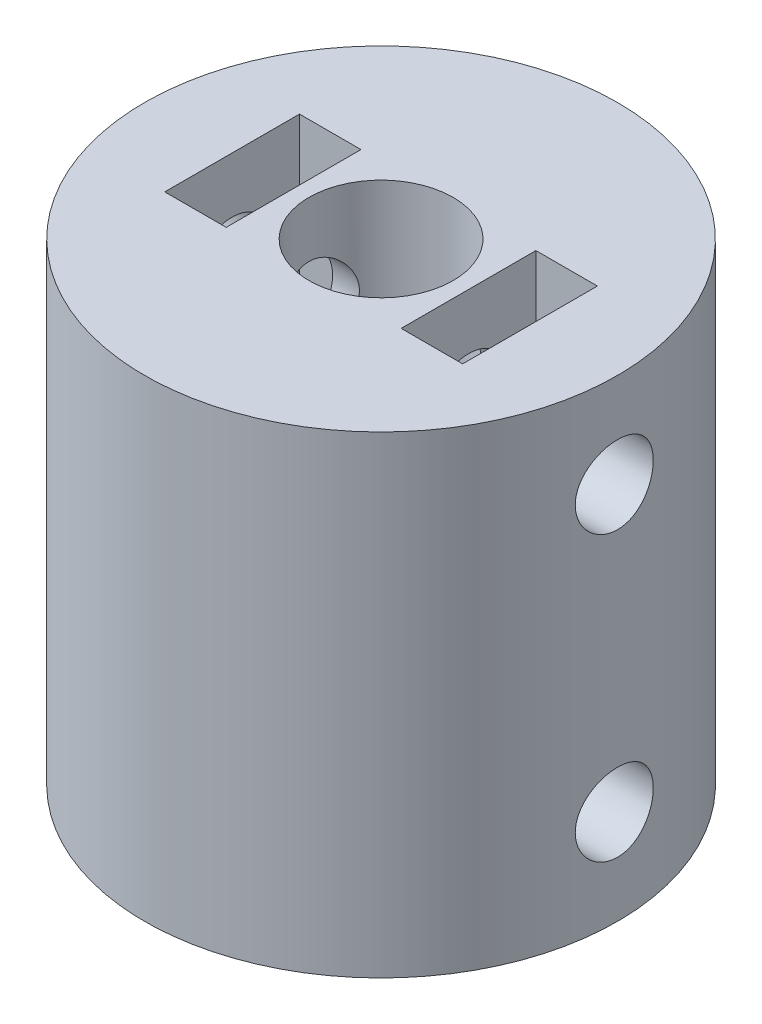
from build123d import *

# Parameters (mm, degrees)
ESBO_O2_W                  = 2.6
ESBO_O2_H                  = 5.7
CORTE_EXTRUS_O1_DEPTH      = 8
CORTE_EXTRUS_O2_START      = -20
ESBO_O2_2_W                = 2.6
ESBO_O2_2_H                = 5.7
CORTE_EXTRUS_O2_DEPTH      = 8
CORTE_EXTRUS_O3_DEPTH      = 27.223844112
CORTE_EXTRUS_O3_DEPTH_BACK = 27.223844112
ESBO_O3_R                  = 1.65


with BuildPart() as part:
    # Esboço1 → Revolução1 (revolve)
    with BuildSketch(Plane.XY, mode=Mode.PRIVATE) as revolu_o1_sk:
        Polygon((3.05, 20), (10, 20), (10, 0), (2.4, 0), (2.4, 8), (3.05, 8), align=None)
    revolve(revolu_o1_sk.sketch.rotate(Axis((0, 0, 0), (0, 1, 0)), 90), axis=Axis((0, 0, 0), (0, 1, 0)))

    # Esboço2 → Corte-extrusão1 (cut)
    with BuildSketch(Plane(origin=(0, 20, 0), x_dir=(1, 0, 0), z_dir=(0, 1, 0))):
        with Locations((5, 0)):
            Rectangle(ESBO_O2_W, ESBO_O2_H)
        with Locations((-5, 0)):
            Rectangle(ESBO_O2_W, ESBO_O2_H)
    extrude(amount=-CORTE_EXTRUS_O1_DEPTH, mode=Mode.SUBTRACT)

    # Esboço2<2> → Corte-extrusão2 (cut)
    with BuildSketch(Plane(origin=(0, 20, 0), x_dir=(1, 0, 0), z_dir=(0, 1, 0)).offset(CORTE_EXTRUS_O2_START)):
        with Locations((5, 0)):
            Rectangle(ESBO_O2_2_W, ESBO_O2_2_H)
        with Locations((-5, 0)):
            Rectangle(ESBO_O2_2_W, ESBO_O2_2_H)
    extrude(amount=CORTE_EXTRUS_O2_DEPTH, mode=Mode.SUBTRACT)

    # Esboço3 → Corte-extrusão3 (cut, two sides: drawn at the far end of the back side and taken through both)
    with BuildSketch(Plane.ZY.offset(3.7).offset(-CORTE_EXTRUS_O3_DEPTH_BACK)):
        with Locations((0, 4)):
            Circle(ESBO_O3_R)
        with Locations((0, 16)):
            Circle(ESBO_O3_R)
    extrude(amount=CORTE_EXTRUS_O3_DEPTH + CORTE_EXTRUS_O3_DEPTH_BACK, mode=Mode.SUBTRACT)


solid = part.part
